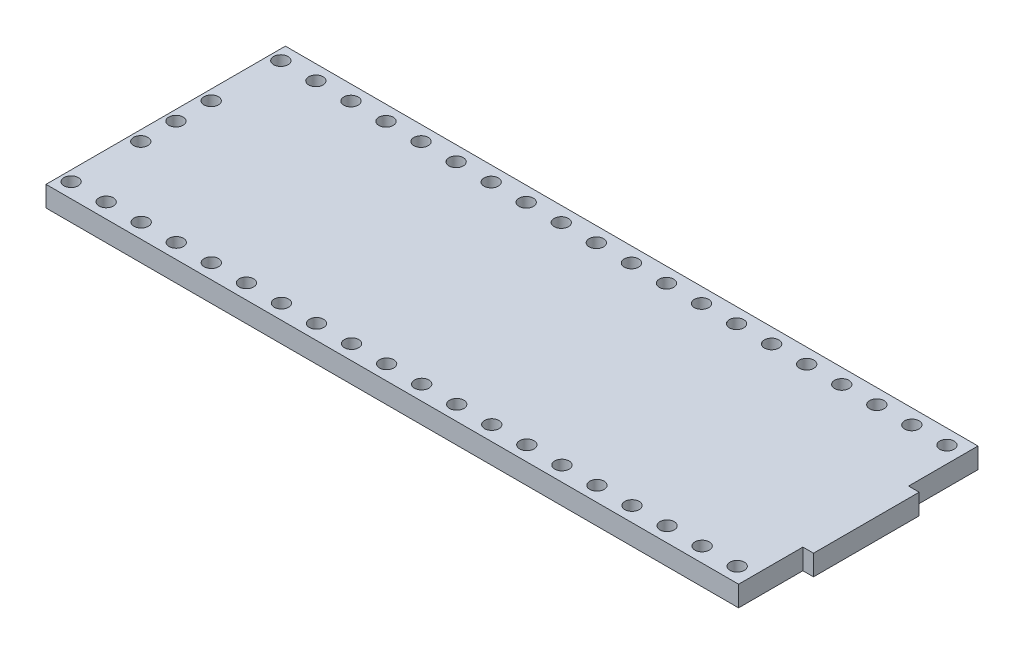
from build123d import *

# Parameters (mm, degrees)
SKETCH2_W                = 52.2224
SKETCH2_H                = 17.78
BOSS_EXTRUDE1_DEPTH      = 1.524
CUT_EXTRUDE1_REACH       = 29.625
SKETCH5_R                = 0.5334
LPATTERN1_COUNT          = 20
LPATTERN1_PITCH          = 2.6035
MIRROR1_COPY_1_REACH     = 29.625
MIRROR1_COPY_1_SKETCH_R  = 0.5334
MIRROR1_COPY_2_REACH     = 29.625
MIRROR1_COPY_2_SKETCH_R  = 0.5334
MIRROR1_COPY_3_REACH     = 29.625
MIRROR1_COPY_3_SKETCH_R  = 0.5334
MIRROR1_COPY_4_REACH     = 29.625
MIRROR1_COPY_4_SKETCH_R  = 0.5334
MIRROR1_COPY_5_REACH     = 29.625
MIRROR1_COPY_5_SKETCH_R  = 0.5334
MIRROR1_COPY_6_REACH     = 29.625
MIRROR1_COPY_6_SKETCH_R  = 0.5334
MIRROR1_COPY_7_REACH     = 29.625
MIRROR1_COPY_7_SKETCH_R  = 0.5334
MIRROR1_COPY_8_REACH     = 29.625
MIRROR1_COPY_8_SKETCH_R  = 0.5334
MIRROR1_COPY_9_REACH     = 29.625
MIRROR1_COPY_9_SKETCH_R  = 0.5334
MIRROR1_COPY_10_REACH    = 29.625
MIRROR1_COPY_10_SKETCH_R = 0.5334
MIRROR1_COPY_11_REACH    = 29.625
MIRROR1_COPY_11_SKETCH_R = 0.5334
MIRROR1_COPY_12_REACH    = 29.625
MIRROR1_COPY_12_SKETCH_R = 0.5334
MIRROR1_COPY_13_REACH    = 29.625
MIRROR1_COPY_13_SKETCH_R = 0.5334
MIRROR1_COPY_14_REACH    = 29.625
MIRROR1_COPY_14_SKETCH_R = 0.5334
MIRROR1_COPY_15_REACH    = 29.625
MIRROR1_COPY_15_SKETCH_R = 0.5334
MIRROR1_COPY_16_REACH    = 29.625
MIRROR1_COPY_16_SKETCH_R = 0.5334
MIRROR1_COPY_17_REACH    = 29.625
MIRROR1_COPY_17_SKETCH_R = 0.5334
MIRROR1_COPY_18_REACH    = 29.625
MIRROR1_COPY_18_SKETCH_R = 0.5334
MIRROR1_COPY_19_REACH    = 29.625
MIRROR1_COPY_19_SKETCH_R = 0.5334
CUT_EXTRUDE2_REACH       = 29.625
SKETCH6_W                = 0.7874
SKETCH6_H                = 4.7752
SKETCH6_H_2              = 5.1562
CUT_EXTRUDE3_REACH       = 29.625
SKETCH7_R                = 0.5334


with BuildPart() as part:
    # Sketch2 → Boss-Extrude1 (new body)
    with BuildSketch(Plane(origin=(0, 0, 0), x_dir=(1, 0, 0), z_dir=(0, 1, 0))):
        Rectangle(SKETCH2_W, SKETCH2_H)
    extrude(amount=BOSS_EXTRUDE1_DEPTH)

    # Sketch5 → Cut-Extrude1 (cut, up to next)
    with BuildSketch(Plane(origin=(0, 1.524, 0), x_dir=(1, 0, 0), z_dir=(0, 1, 0)), mode=Mode.PRIVATE) as cut_extrude1_sk1:
        with Locations(Location((-25.3492, -7.787691989, 0), (0, 0, 270))):
            Circle(SKETCH5_R)
    cut_extrude1_tool1 = extrude(cut_extrude1_sk1.sketch, amount=-CUT_EXTRUDE1_REACH, mode=Mode.PRIVATE) & part.part
    cut_extrude1 = cut_extrude1_tool1.solids().sort_by_distance((-25.3492, 1.524, 7.787692))[0]
    add(cut_extrude1, mode=Mode.SUBTRACT)

    # LPattern1: Cut-Extrude1 ×20
    with Locations(*[(i * LPATTERN1_PITCH, 0, 0) for i in range(1, LPATTERN1_COUNT)]):
        add(cut_extrude1, mode=Mode.SUBTRACT)

    # Mirror1: Cut-Extrude1 across plane
    add(cut_extrude1.mirror(Plane.XY), mode=Mode.SUBTRACT)

    # Mirror1 copy 1 sketch → Mirror1 copy 1 (cut, up to next)
    with BuildSketch(Plane(origin=(2.6035, 1.524, 0), x_dir=(1, 0, 0), z_dir=(0, 1, 0)), mode=Mode.PRIVATE) as mirror1_copy_1_sk1:
        with Locations((-25.3492, 7.787691989)):
            Circle(MIRROR1_COPY_1_SKETCH_R)
    mirror1_copy_1_tool1 = extrude(mirror1_copy_1_sk1.sketch, amount=-MIRROR1_COPY_1_REACH, mode=Mode.PRIVATE) & part.part
    add(mirror1_copy_1_tool1.solids().sort_by_distance((-22.7457, 1.524, -7.787692))[0], mode=Mode.SUBTRACT)

    # Mirror1 copy 2 sketch → Mirror1 copy 2 (cut, up to next)
    with BuildSketch(Plane(origin=(5.207, 1.524, 0), x_dir=(1, 0, 0), z_dir=(0, 1, 0)), mode=Mode.PRIVATE) as mirror1_copy_2_sk1:
        with Locations((-25.3492, 7.787691989)):
            Circle(MIRROR1_COPY_2_SKETCH_R)
    mirror1_copy_2_tool1 = extrude(mirror1_copy_2_sk1.sketch, amount=-MIRROR1_COPY_2_REACH, mode=Mode.PRIVATE) & part.part
    add(mirror1_copy_2_tool1.solids().sort_by_distance((-20.1422, 1.524, -7.787692))[0], mode=Mode.SUBTRACT)

    # Mirror1 copy 3 sketch → Mirror1 copy 3 (cut, up to next)
    with BuildSketch(Plane(origin=(7.8105, 1.524, 0), x_dir=(1, 0, 0), z_dir=(0, 1, 0)), mode=Mode.PRIVATE) as mirror1_copy_3_sk1:
        with Locations((-25.3492, 7.787691989)):
            Circle(MIRROR1_COPY_3_SKETCH_R)
    mirror1_copy_3_tool1 = extrude(mirror1_copy_3_sk1.sketch, amount=-MIRROR1_COPY_3_REACH, mode=Mode.PRIVATE) & part.part
    add(mirror1_copy_3_tool1.solids().sort_by_distance((-17.5387, 1.524, -7.787692))[0], mode=Mode.SUBTRACT)

    # Mirror1 copy 4 sketch → Mirror1 copy 4 (cut, up to next)
    with BuildSketch(Plane(origin=(10.414, 1.524, 0), x_dir=(1, 0, 0), z_dir=(0, 1, 0)), mode=Mode.PRIVATE) as mirror1_copy_4_sk1:
        with Locations((-25.3492, 7.787691989)):
            Circle(MIRROR1_COPY_4_SKETCH_R)
    mirror1_copy_4_tool1 = extrude(mirror1_copy_4_sk1.sketch, amount=-MIRROR1_COPY_4_REACH, mode=Mode.PRIVATE) & part.part
    add(mirror1_copy_4_tool1.solids().sort_by_distance((-14.9352, 1.524, -7.787692))[0], mode=Mode.SUBTRACT)

    # Mirror1 copy 5 sketch → Mirror1 copy 5 (cut, up to next)
    with BuildSketch(Plane(origin=(13.0175, 1.524, 0), x_dir=(1, 0, 0), z_dir=(0, 1, 0)), mode=Mode.PRIVATE) as mirror1_copy_5_sk1:
        with Locations((-25.3492, 7.787691989)):
            Circle(MIRROR1_COPY_5_SKETCH_R)
    mirror1_copy_5_tool1 = extrude(mirror1_copy_5_sk1.sketch, amount=-MIRROR1_COPY_5_REACH, mode=Mode.PRIVATE) & part.part
    add(mirror1_copy_5_tool1.solids().sort_by_distance((-12.3317, 1.524, -7.787692))[0], mode=Mode.SUBTRACT)

    # Mirror1 copy 6 sketch → Mirror1 copy 6 (cut, up to next)
    with BuildSketch(Plane(origin=(15.621, 1.524, 0), x_dir=(1, 0, 0), z_dir=(0, 1, 0)), mode=Mode.PRIVATE) as mirror1_copy_6_sk1:
        with Locations((-25.3492, 7.787691989)):
            Circle(MIRROR1_COPY_6_SKETCH_R)
    mirror1_copy_6_tool1 = extrude(mirror1_copy_6_sk1.sketch, amount=-MIRROR1_COPY_6_REACH, mode=Mode.PRIVATE) & part.part
    add(mirror1_copy_6_tool1.solids().sort_by_distance((-9.7282, 1.524, -7.787692))[0], mode=Mode.SUBTRACT)

    # Mirror1 copy 7 sketch → Mirror1 copy 7 (cut, up to next)
    with BuildSketch(Plane(origin=(18.2245, 1.524, 0), x_dir=(1, 0, 0), z_dir=(0, 1, 0)), mode=Mode.PRIVATE) as mirror1_copy_7_sk1:
        with Locations((-25.3492, 7.787691989)):
            Circle(MIRROR1_COPY_7_SKETCH_R)
    mirror1_copy_7_tool1 = extrude(mirror1_copy_7_sk1.sketch, amount=-MIRROR1_COPY_7_REACH, mode=Mode.PRIVATE) & part.part
    add(mirror1_copy_7_tool1.solids().sort_by_distance((-7.1247, 1.524, -7.787692))[0], mode=Mode.SUBTRACT)

    # Mirror1 copy 8 sketch → Mirror1 copy 8 (cut, up to next)
    with BuildSketch(Plane(origin=(20.828, 1.524, 0), x_dir=(1, 0, 0), z_dir=(0, 1, 0)), mode=Mode.PRIVATE) as mirror1_copy_8_sk1:
        with Locations((-25.3492, 7.787691989)):
            Circle(MIRROR1_COPY_8_SKETCH_R)
    mirror1_copy_8_tool1 = extrude(mirror1_copy_8_sk1.sketch, amount=-MIRROR1_COPY_8_REACH, mode=Mode.PRIVATE) & part.part
    add(mirror1_copy_8_tool1.solids().sort_by_distance((-4.5212, 1.524, -7.787692))[0], mode=Mode.SUBTRACT)

    # Mirror1 copy 9 sketch → Mirror1 copy 9 (cut, up to next)
    with BuildSketch(Plane(origin=(23.4315, 1.524, 0), x_dir=(1, 0, 0), z_dir=(0, 1, 0)), mode=Mode.PRIVATE) as mirror1_copy_9_sk1:
        with Locations((-25.3492, 7.787691989)):
            Circle(MIRROR1_COPY_9_SKETCH_R)
    mirror1_copy_9_tool1 = extrude(mirror1_copy_9_sk1.sketch, amount=-MIRROR1_COPY_9_REACH, mode=Mode.PRIVATE) & part.part
    add(mirror1_copy_9_tool1.solids().sort_by_distance((-1.9177, 1.524, -7.787692))[0], mode=Mode.SUBTRACT)

    # Mirror1 copy 10 sketch → Mirror1 copy 10 (cut, up to next)
    with BuildSketch(Plane(origin=(26.035, 1.524, 0), x_dir=(1, 0, 0), z_dir=(0, 1, 0)), mode=Mode.PRIVATE) as mirror1_copy_10_sk1:
        with Locations((-25.3492, 7.787691989)):
            Circle(MIRROR1_COPY_10_SKETCH_R)
    mirror1_copy_10_tool1 = extrude(mirror1_copy_10_sk1.sketch, amount=-MIRROR1_COPY_10_REACH, mode=Mode.PRIVATE) & part.part
    add(mirror1_copy_10_tool1.solids().sort_by_distance((0.6858, 1.524, -7.787692))[0], mode=Mode.SUBTRACT)

    # Mirror1 copy 11 sketch → Mirror1 copy 11 (cut, up to next)
    with BuildSketch(Plane(origin=(28.6385, 1.524, 0), x_dir=(1, 0, 0), z_dir=(0, 1, 0)), mode=Mode.PRIVATE) as mirror1_copy_11_sk1:
        with Locations((-25.3492, 7.787691989)):
            Circle(MIRROR1_COPY_11_SKETCH_R)
    mirror1_copy_11_tool1 = extrude(mirror1_copy_11_sk1.sketch, amount=-MIRROR1_COPY_11_REACH, mode=Mode.PRIVATE) & part.part
    add(mirror1_copy_11_tool1.solids().sort_by_distance((3.2893, 1.524, -7.787692))[0], mode=Mode.SUBTRACT)

    # Mirror1 copy 12 sketch → Mirror1 copy 12 (cut, up to next)
    with BuildSketch(Plane(origin=(31.242, 1.524, 0), x_dir=(1, 0, 0), z_dir=(0, 1, 0)), mode=Mode.PRIVATE) as mirror1_copy_12_sk1:
        with Locations((-25.3492, 7.787691989)):
            Circle(MIRROR1_COPY_12_SKETCH_R)
    mirror1_copy_12_tool1 = extrude(mirror1_copy_12_sk1.sketch, amount=-MIRROR1_COPY_12_REACH, mode=Mode.PRIVATE) & part.part
    add(mirror1_copy_12_tool1.solids().sort_by_distance((5.8928, 1.524, -7.787692))[0], mode=Mode.SUBTRACT)

    # Mirror1 copy 13 sketch → Mirror1 copy 13 (cut, up to next)
    with BuildSketch(Plane(origin=(33.8455, 1.524, 0), x_dir=(1, 0, 0), z_dir=(0, 1, 0)), mode=Mode.PRIVATE) as mirror1_copy_13_sk1:
        with Locations((-25.3492, 7.787691989)):
            Circle(MIRROR1_COPY_13_SKETCH_R)
    mirror1_copy_13_tool1 = extrude(mirror1_copy_13_sk1.sketch, amount=-MIRROR1_COPY_13_REACH, mode=Mode.PRIVATE) & part.part
    add(mirror1_copy_13_tool1.solids().sort_by_distance((8.4963, 1.524, -7.787692))[0], mode=Mode.SUBTRACT)

    # Mirror1 copy 14 sketch → Mirror1 copy 14 (cut, up to next)
    with BuildSketch(Plane(origin=(36.449, 1.524, 0), x_dir=(1, 0, 0), z_dir=(0, 1, 0)), mode=Mode.PRIVATE) as mirror1_copy_14_sk1:
        with Locations((-25.3492, 7.787691989)):
            Circle(MIRROR1_COPY_14_SKETCH_R)
    mirror1_copy_14_tool1 = extrude(mirror1_copy_14_sk1.sketch, amount=-MIRROR1_COPY_14_REACH, mode=Mode.PRIVATE) & part.part
    add(mirror1_copy_14_tool1.solids().sort_by_distance((11.0998, 1.524, -7.787692))[0], mode=Mode.SUBTRACT)

    # Mirror1 copy 15 sketch → Mirror1 copy 15 (cut, up to next)
    with BuildSketch(Plane(origin=(39.0525, 1.524, 0), x_dir=(1, 0, 0), z_dir=(0, 1, 0)), mode=Mode.PRIVATE) as mirror1_copy_15_sk1:
        with Locations((-25.3492, 7.787691989)):
            Circle(MIRROR1_COPY_15_SKETCH_R)
    mirror1_copy_15_tool1 = extrude(mirror1_copy_15_sk1.sketch, amount=-MIRROR1_COPY_15_REACH, mode=Mode.PRIVATE) & part.part
    add(mirror1_copy_15_tool1.solids().sort_by_distance((13.7033, 1.524, -7.787692))[0], mode=Mode.SUBTRACT)

    # Mirror1 copy 16 sketch → Mirror1 copy 16 (cut, up to next)
    with BuildSketch(Plane(origin=(41.656, 1.524, 0), x_dir=(1, 0, 0), z_dir=(0, 1, 0)), mode=Mode.PRIVATE) as mirror1_copy_16_sk1:
        with Locations((-25.3492, 7.787691989)):
            Circle(MIRROR1_COPY_16_SKETCH_R)
    mirror1_copy_16_tool1 = extrude(mirror1_copy_16_sk1.sketch, amount=-MIRROR1_COPY_16_REACH, mode=Mode.PRIVATE) & part.part
    add(mirror1_copy_16_tool1.solids().sort_by_distance((16.3068, 1.524, -7.787692))[0], mode=Mode.SUBTRACT)

    # Mirror1 copy 17 sketch → Mirror1 copy 17 (cut, up to next)
    with BuildSketch(Plane(origin=(44.2595, 1.524, 0), x_dir=(1, 0, 0), z_dir=(0, 1, 0)), mode=Mode.PRIVATE) as mirror1_copy_17_sk1:
        with Locations((-25.3492, 7.787691989)):
            Circle(MIRROR1_COPY_17_SKETCH_R)
    mirror1_copy_17_tool1 = extrude(mirror1_copy_17_sk1.sketch, amount=-MIRROR1_COPY_17_REACH, mode=Mode.PRIVATE) & part.part
    add(mirror1_copy_17_tool1.solids().sort_by_distance((18.9103, 1.524, -7.787692))[0], mode=Mode.SUBTRACT)

    # Mirror1 copy 18 sketch → Mirror1 copy 18 (cut, up to next)
    with BuildSketch(Plane(origin=(46.863, 1.524, 0), x_dir=(1, 0, 0), z_dir=(0, 1, 0)), mode=Mode.PRIVATE) as mirror1_copy_18_sk1:
        with Locations((-25.3492, 7.787691989)):
            Circle(MIRROR1_COPY_18_SKETCH_R)
    mirror1_copy_18_tool1 = extrude(mirror1_copy_18_sk1.sketch, amount=-MIRROR1_COPY_18_REACH, mode=Mode.PRIVATE) & part.part
    add(mirror1_copy_18_tool1.solids().sort_by_distance((21.5138, 1.524, -7.787692))[0], mode=Mode.SUBTRACT)

    # Mirror1 copy 19 sketch → Mirror1 copy 19 (cut, up to next)
    with BuildSketch(Plane(origin=(49.4665, 1.524, 0), x_dir=(1, 0, 0), z_dir=(0, 1, 0)), mode=Mode.PRIVATE) as mirror1_copy_19_sk1:
        with Locations((-25.3492, 7.787691989)):
            Circle(MIRROR1_COPY_19_SKETCH_R)
    mirror1_copy_19_tool1 = extrude(mirror1_copy_19_sk1.sketch, amount=-MIRROR1_COPY_19_REACH, mode=Mode.PRIVATE) & part.part
    add(mirror1_copy_19_tool1.solids().sort_by_distance((24.1173, 1.524, -7.787692))[0], mode=Mode.SUBTRACT)

    # Sketch6 → Cut-Extrude2 (cut, up to next)
    with BuildSketch(Plane(origin=(0, 1.524, 0), x_dir=(1, 0, 0), z_dir=(0, 1, 0)), mode=Mode.PRIVATE) as cut_extrude2_sk1:
        with Locations((25.7175, -6.5024)):
            Rectangle(SKETCH6_W, SKETCH6_H)
    cut_extrude2_tool1 = extrude(cut_extrude2_sk1.sketch, amount=-CUT_EXTRUDE2_REACH, mode=Mode.PRIVATE) & part.part
    # Sketch6 → Cut-Extrude2 (cut, up to next)
    with BuildSketch(Plane(origin=(0, 1.524, 0), x_dir=(1, 0, 0), z_dir=(0, 1, 0)), mode=Mode.PRIVATE) as cut_extrude2_sk2:
        with Locations((25.7175, 6.3119)):
            Rectangle(SKETCH6_W, SKETCH6_H_2)
    cut_extrude2_tool2 = extrude(cut_extrude2_sk2.sketch, amount=-CUT_EXTRUDE2_REACH, mode=Mode.PRIVATE) & part.part
    add(cut_extrude2_tool1.solids().sort_by_distance((25.7175, 1.524, 6.5024))[0], mode=Mode.SUBTRACT)
    add(cut_extrude2_tool2.solids().sort_by_distance((25.7175, 1.524, -6.3119))[0], mode=Mode.SUBTRACT)

    # Sketch7 → Cut-Extrude3 (cut, up to next)
    with BuildSketch(Plane(origin=(0, 1.524, 0), x_dir=(1, 0, 0), z_dir=(0, 1, 0)), mode=Mode.PRIVATE) as cut_extrude3_sk1:
        with Locations(Location((-25.3492, 0, 0), (0, 0, 270))):
            Circle(SKETCH7_R)
    cut_extrude3_tool1 = extrude(cut_extrude3_sk1.sketch, amount=-CUT_EXTRUDE3_REACH, mode=Mode.PRIVATE) & part.part
    # Sketch7 → Cut-Extrude3 (cut, up to next)
    with BuildSketch(Plane(origin=(0, 1.524, 0), x_dir=(1, 0, 0), z_dir=(0, 1, 0)), mode=Mode.PRIVATE) as cut_extrude3_sk2:
        with Locations(Location((-25.3492, 2.6162, 0), (0, 0, 270))):
            Circle(SKETCH7_R)
    cut_extrude3_tool2 = extrude(cut_extrude3_sk2.sketch, amount=-CUT_EXTRUDE3_REACH, mode=Mode.PRIVATE) & part.part
    # Sketch7 → Cut-Extrude3 (cut, up to next)
    with BuildSketch(Plane(origin=(0, 1.524, 0), x_dir=(1, 0, 0), z_dir=(0, 1, 0)), mode=Mode.PRIVATE) as cut_extrude3_sk3:
        with Locations(Location((-25.3492, -2.6162, 0), (0, 0, 270))):
            Circle(SKETCH7_R)
    cut_extrude3_tool3 = extrude(cut_extrude3_sk3.sketch, amount=-CUT_EXTRUDE3_REACH, mode=Mode.PRIVATE) & part.part
    add(cut_extrude3_tool1.solids().sort_by_distance((-25.3492, 1.524, 0))[0], mode=Mode.SUBTRACT)
    add(cut_extrude3_tool2.solids().sort_by_distance((-25.3492, 1.524, -2.6162))[0], mode=Mode.SUBTRACT)
    add(cut_extrude3_tool3.solids().sort_by_distance((-25.3492, 1.524, 2.6162))[0], mode=Mode.SUBTRACT)


solid = part.part
